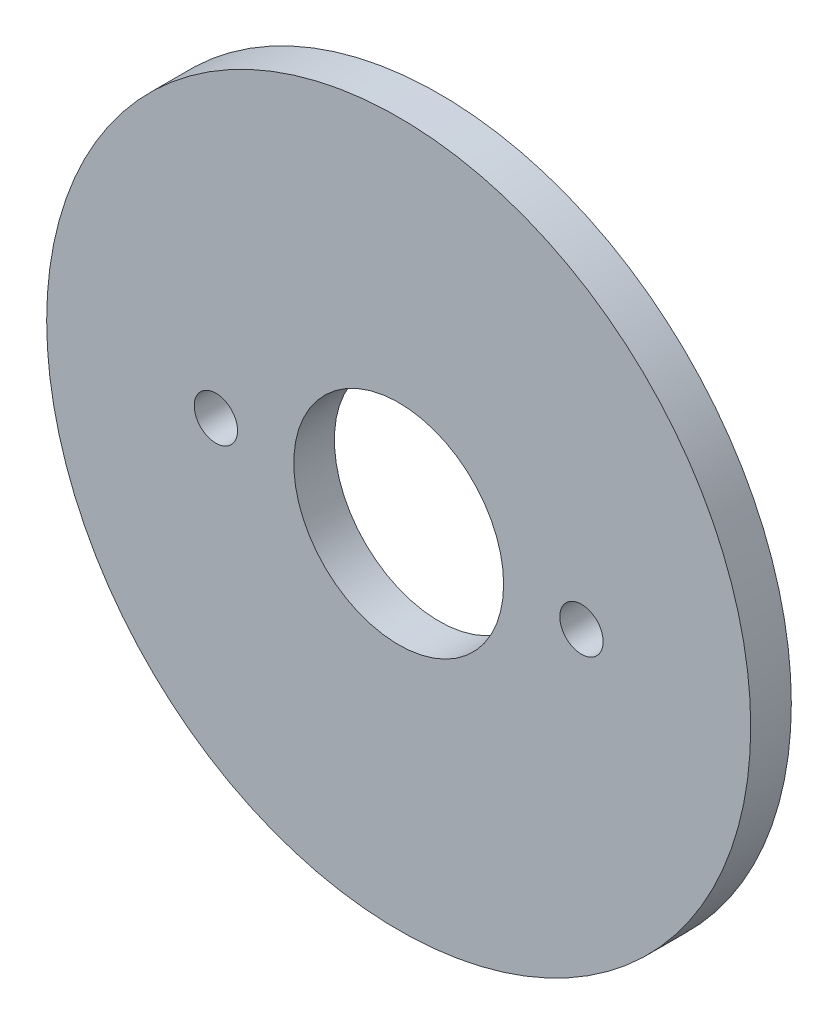
from build123d import *

# Parameters (mm, degrees)
ESBO_O1_R                = 26
ESBO_O1_R_2              = 7.75
ESBO_O1_R_3              = 1.6
RESSALTO_EXTRUS_O1_DEPTH = 1.5


with BuildPart() as part:
    # Esboço1 → Ressalto-extrusão1 (new, symmetric)
    with BuildSketch(Plane.XY):
        Circle(ESBO_O1_R)
        Circle(ESBO_O1_R_2, mode=Mode.SUBTRACT)
        with Locations((-13.5, 0)):
            Circle(ESBO_O1_R_3, mode=Mode.SUBTRACT)
        with Locations((13.5, 0)):
            Circle(ESBO_O1_R_3, mode=Mode.SUBTRACT)
    extrude(amount=RESSALTO_EXTRUS_O1_DEPTH, both=True)


solid = part.part
